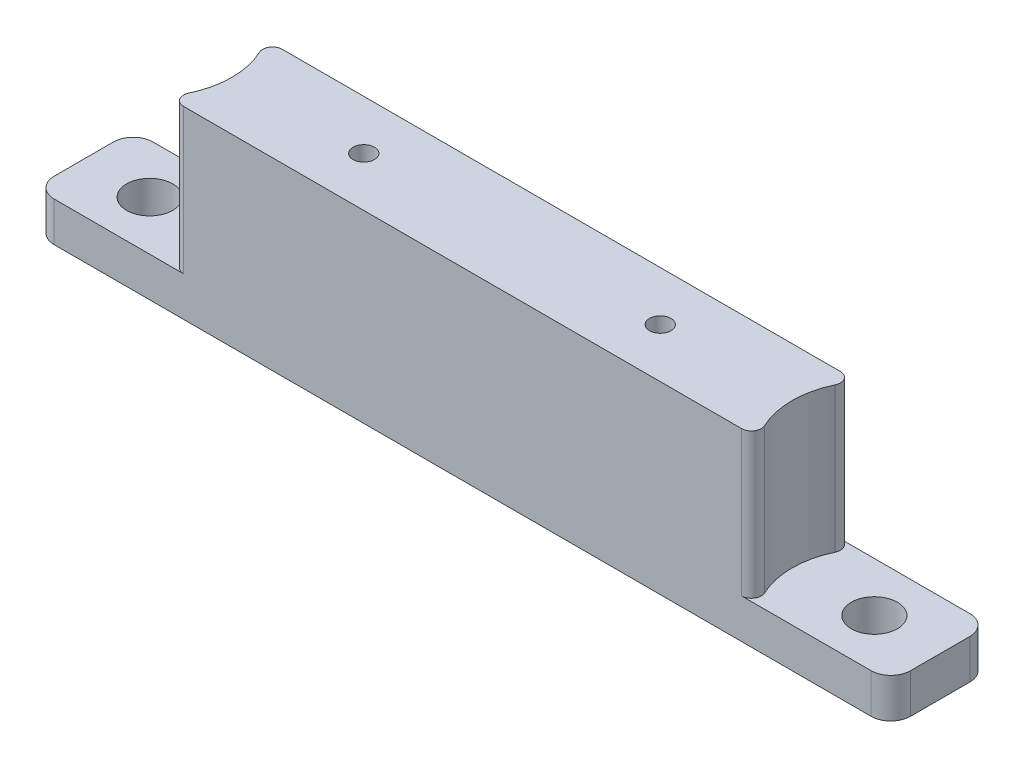
from build123d import *

# Parameters (mm, degrees)
SKETCH1_W           = 130
SKETCH1_H           = 15
BOSS_EXTRUDE1_DEPTH = 6
SKETCH2_W           = 90
SKETCH2_H           = 15
BOSS_EXTRUDE2_DEPTH = 22
CUT_EXTRUDE1_REACH  = 134.699
SKETCH3_R           = 3.5
CUT_EXTRUDE2_REACH  = 134.699
SKETCH4_R           = 12.5
CUT_EXTRUDE3_REACH  = 135.825
SKETCH5_R           = 1.625
SKETCH6_R           = 3.5
CUT_EXTRUDE4_DEPTH  = 25.5
FILLET1_R           = 3
FILLET3_R           = 1.5


with BuildPart() as part:
    # Sketch1 → Boss-Extrude1 (new body)
    with BuildSketch(Plane(origin=(0, 0, 0), x_dir=(1, 0, 0), z_dir=(0, 1, 0))):
        with Locations((65, 7.5)):
            Rectangle(SKETCH1_W, SKETCH1_H)
    extrude(amount=BOSS_EXTRUDE1_DEPTH)

    # Sketch2 → Boss-Extrude2 (add)
    with BuildSketch(Plane(origin=(0, 6, 0), x_dir=(1, 0, 0), z_dir=(0, 1, 0))):
        with Locations((65, 7.5)):
            Rectangle(SKETCH2_W, SKETCH2_H)
    extrude(amount=BOSS_EXTRUDE2_DEPTH)

    # Sketch3 → Cut-Extrude1 (cut, up to next)
    with BuildSketch(Plane(origin=(0, 6, 0), x_dir=(1, 0, 0), z_dir=(0, 1, 0)), mode=Mode.PRIVATE) as cut_extrude1_sk1:
        with Locations(Location((10, 7.5, 0), (0, 0, 270))):
            Circle(SKETCH3_R)
    cut_extrude1_tool1 = extrude(cut_extrude1_sk1.sketch, amount=-CUT_EXTRUDE1_REACH, mode=Mode.PRIVATE) & part.part
    # Sketch3 → Cut-Extrude1 (cut, up to next)
    with BuildSketch(Plane(origin=(0, 6, 0), x_dir=(1, 0, 0), z_dir=(0, 1, 0)), mode=Mode.PRIVATE) as cut_extrude1_sk2:
        with Locations(Location((120, 7.5, 0), (0, 0, 270))):
            Circle(SKETCH3_R)
    cut_extrude1_tool2 = extrude(cut_extrude1_sk2.sketch, amount=-CUT_EXTRUDE1_REACH, mode=Mode.PRIVATE) & part.part
    add(cut_extrude1_tool1.solids().sort_by_distance((10, 6, -7.5))[0], mode=Mode.SUBTRACT)
    add(cut_extrude1_tool2.solids().sort_by_distance((120, 6, -7.5))[0], mode=Mode.SUBTRACT)

    # Sketch4 → Cut-Extrude2 (cut, up to next)
    with BuildSketch(Plane(origin=(0, 6, 0), x_dir=(1, 0, 0), z_dir=(0, 1, 0)), mode=Mode.PRIVATE) as cut_extrude2_sk1:
        with Locations((10, 7.5)):
            Circle(SKETCH4_R)
    cut_extrude2_tool1 = extrude(cut_extrude2_sk1.sketch, amount=CUT_EXTRUDE2_REACH, mode=Mode.PRIVATE) & part.part
    # Sketch4 → Cut-Extrude2 (cut, up to next)
    with BuildSketch(Plane(origin=(0, 6, 0), x_dir=(1, 0, 0), z_dir=(0, 1, 0)), mode=Mode.PRIVATE) as cut_extrude2_sk2:
        with Locations((120, 7.5)):
            Circle(SKETCH4_R)
    cut_extrude2_tool2 = extrude(cut_extrude2_sk2.sketch, amount=CUT_EXTRUDE2_REACH, mode=Mode.PRIVATE) & part.part
    add(cut_extrude2_tool1.solids().sort_by_distance((10, 6, -7.5))[0], mode=Mode.SUBTRACT)
    add(cut_extrude2_tool2.solids().sort_by_distance((120, 6, -7.5))[0], mode=Mode.SUBTRACT)

    # Sketch5 → Cut-Extrude3 (cut, up to next)
    with BuildSketch(Plane(origin=(0, 28, 0), x_dir=(1, 0, 0), z_dir=(0, 1, 0)), mode=Mode.PRIVATE) as cut_extrude3_sk1:
        with Locations(Location((42.5, 7.5, 0), (0, 0, 270))):
            Circle(SKETCH5_R)
    cut_extrude3_tool1 = extrude(cut_extrude3_sk1.sketch, amount=-CUT_EXTRUDE3_REACH, mode=Mode.PRIVATE) & part.part
    # Sketch5 → Cut-Extrude3 (cut, up to next)
    with BuildSketch(Plane(origin=(0, 28, 0), x_dir=(1, 0, 0), z_dir=(0, 1, 0)), mode=Mode.PRIVATE) as cut_extrude3_sk2:
        with Locations(Location((87.5, 7.5, 0), (0, 0, 270))):
            Circle(SKETCH5_R)
    cut_extrude3_tool2 = extrude(cut_extrude3_sk2.sketch, amount=-CUT_EXTRUDE3_REACH, mode=Mode.PRIVATE) & part.part
    add(cut_extrude3_tool1.solids().sort_by_distance((42.5, 28, -7.5))[0], mode=Mode.SUBTRACT)
    add(cut_extrude3_tool2.solids().sort_by_distance((87.5, 28, -7.5))[0], mode=Mode.SUBTRACT)

    # Sketch6 → Cut-Extrude4 (cut)
    with BuildSketch(Plane.XZ):
        with Locations(Location((42.5, -7.5, 0), (0, 0, 270))):
            Circle(SKETCH6_R)
        with Locations(Location((87.5, -7.5, 0), (0, 0, 270))):
            Circle(SKETCH6_R)
    extrude(amount=-CUT_EXTRUDE4_DEPTH, mode=Mode.SUBTRACT)

    # Fillet1
    fillet1_edges = [part.edges().sort_by_distance(p)[0] for p in [
        (0, 3, -15),
        (130, 3, -15),
        (130, 3, 0),
        (0, 3, 0),
    ]]
    fillet(fillet1_edges, radius=FILLET1_R)

    # Fillet3
    fillet3_edges = [part.edges().sort_by_distance(p)[0] for p in [
        (20, 17, -15),
        (20, 17, 0),
        (110, 17, 0),
        (110, 17, -15),
    ]]
    fillet(fillet3_edges, radius=FILLET3_R)


solid = part.part
